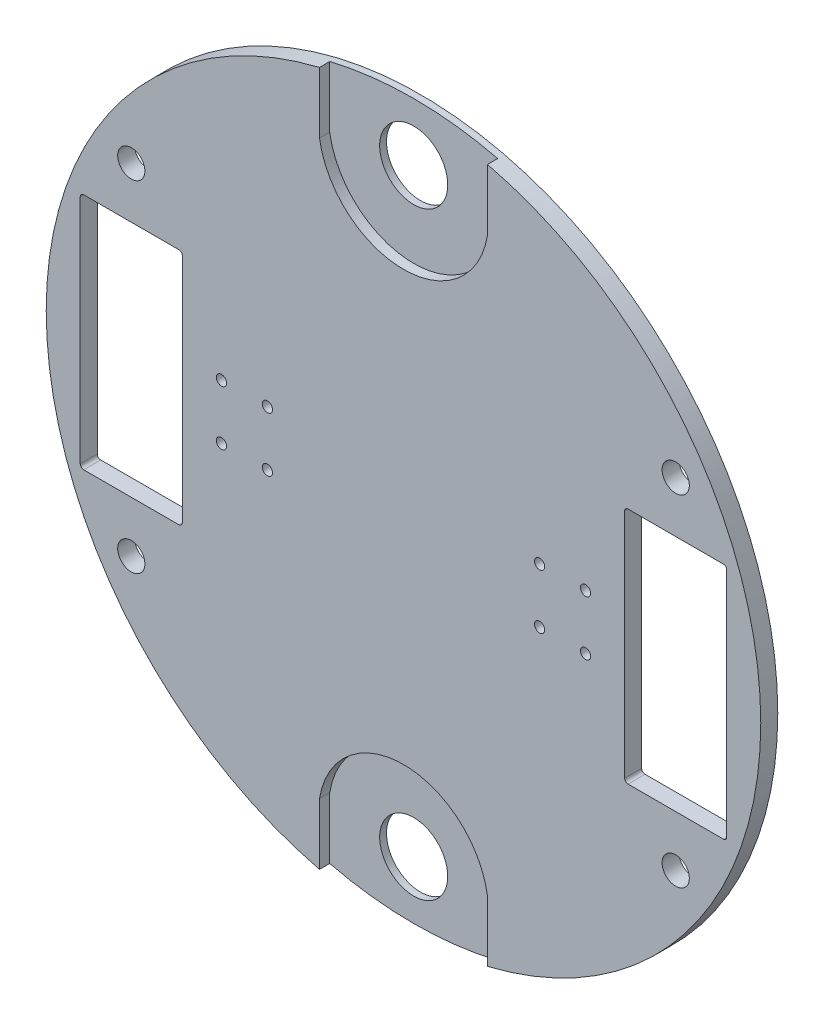
from build123d import *

# Parameters (mm, degrees)
ESQUISSE1_R             = 105
ESQUISSE1_R_2           = 4
ESQUISSE1_W             = 30
ESQUISSE1_H             = 70
BOSS_EXTRU_1_DEPTH      = 5
ESQUISSE2_R             = 1.5
ENL_V_MAT_EXTRU_1_DEPTH = 149.576579581
CONG_1_R                = 1
ENL_V_START             = -3
ENL_V_MAT_EXTRU_2_DEPTH = 3
ESQUISSE4_R             = 10
ENL_V_MAT_EXTRU_3_DEPTH = 149.576579581


with BuildPart() as part:
    # Esquisse1 → Boss.-Extru.1 (new body)
    with BuildSketch(Plane.XY):
        Circle(ESQUISSE1_R)
        with Locations((-80, 50)):
            Circle(ESQUISSE1_R_2, mode=Mode.SUBTRACT)
        with Locations(Location((80, 50, 0), (0, 0, 180))):
            Circle(ESQUISSE1_R_2, mode=Mode.SUBTRACT)
        with Locations((80, -50)):
            Circle(ESQUISSE1_R_2, mode=Mode.SUBTRACT)
        with Locations(Location((-80, -50, 0), (0, 0, 180))):
            Circle(ESQUISSE1_R_2, mode=Mode.SUBTRACT)
        with Locations((-80, 0)):
            Rectangle(ESQUISSE1_W, ESQUISSE1_H, mode=Mode.SUBTRACT)
        with Locations((80, 0)):
            Rectangle(ESQUISSE1_W, ESQUISSE1_H, mode=Mode.SUBTRACT)
    extrude(amount=BOSS_EXTRU_1_DEPTH)

    # Esquisse2 → Enlèv. mat.-Extru.1 (cut, through all)
    with BuildSketch(Plane.XY.offset(5)):
        with Locations((-53.5, -8.042853971)):
            Circle(ESQUISSE2_R)
        with Locations((-40, -8.042853971)):
            Circle(ESQUISSE2_R)
        with Locations((-53.5, 8.042853971)):
            Circle(ESQUISSE2_R)
        with Locations((-40, 8.042853971)):
            Circle(ESQUISSE2_R)
        with Locations(Location((40, 8.042853971, 0), (0, 0, 180))):
            Circle(ESQUISSE2_R)
        with Locations(Location((53.5, 8.042853971, 0), (0, 0, 180))):
            Circle(ESQUISSE2_R)
        with Locations(Location((40, -8.042853971, 0), (0, 0, 180))):
            Circle(ESQUISSE2_R)
        with Locations(Location((53.5, -8.042853971, 0), (0, 0, 180))):
            Circle(ESQUISSE2_R)
    extrude(amount=-ENL_V_MAT_EXTRU_1_DEPTH, mode=Mode.SUBTRACT)

    # Congé1
    cong_1_edges = [part.edges().sort_by_distance(p)[0] for p in [
        (95, -35, 2.5),
        (95, 35, 2.5),
        (65, 35, 2.5),
        (65, -35, 2.5),
        (-65, -35, 2.5),
        (-65, 35, 2.5),
        (-95, 35, 2.5),
        (-95, -35, 2.5),
    ]]
    fillet(cong_1_edges, radius=CONG_1_R)

    # Esquisse3 → Enlèv. mat.-Extru.2 (cut)
    with BuildSketch(Plane.XY.offset(5).offset(ENL_V_START)):
        with BuildLine():
            ThreePointArc((24.687033564, 102.056603774), (0, 105), (-24.687033564, 102.056603774))
            Line((-24.687033564, 102.056603774), (-24.687033564, 84.056603774))
            ThreePointArc((-24.687033564, 84.056603774), (0, 63), (24.687033564, 84.056603774))
            Line((24.687033564, 84.056603774), (24.687033564, 102.056603774))
        make_face()
        with BuildLine():
            ThreePointArc((24.687033564, -84.056603774), (0, -63), (-24.687033564, -84.056603774))
            Line((-24.687033564, -84.056603774), (-24.687033564, -102.056603774))
            ThreePointArc((-24.687033564, -102.056603774), (0, -105), (24.687033564, -102.056603774))
            Line((24.687033564, -102.056603774), (24.687033564, -84.056603774))
        make_face()
    extrude(amount=ENL_V_MAT_EXTRU_2_DEPTH, mode=Mode.SUBTRACT)

    # Esquisse4 → Enlèv. mat.-Extru.3 (cut, through all)
    with BuildSketch(Plane.XY.offset(5)):
        with Locations((0, 88)):
            Circle(ESQUISSE4_R)
        with Locations((0, -88)):
            Circle(ESQUISSE4_R)
    extrude(amount=-ENL_V_MAT_EXTRU_3_DEPTH, mode=Mode.SUBTRACT)


solid = part.part
